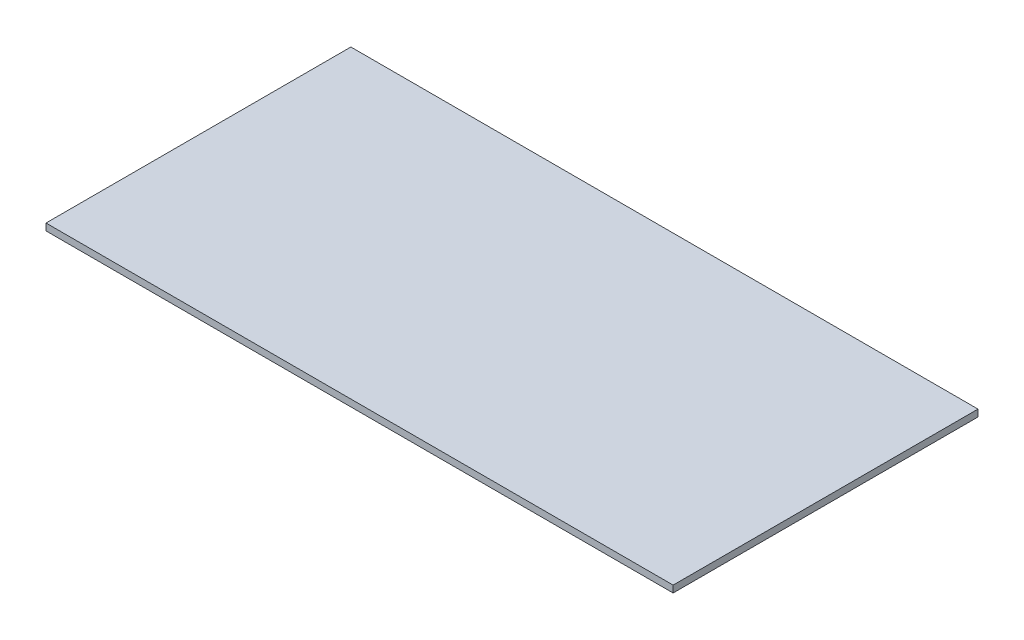
from build123d import *

# Parameters (mm, degrees)
SKETCH1_W           = 457.2
SKETCH1_H           = 222.25
BOSS_EXTRUDE1_DEPTH = 5


with BuildPart() as part:
    # Sketch1 → Boss-Extrude1 (new body)
    with BuildSketch(Plane(origin=(0, 0, 0), x_dir=(1, 0, 0), z_dir=(0, 1, 0))):
        Rectangle(SKETCH1_W, SKETCH1_H)
    extrude(amount=BOSS_EXTRUDE1_DEPTH)


solid = part.part
